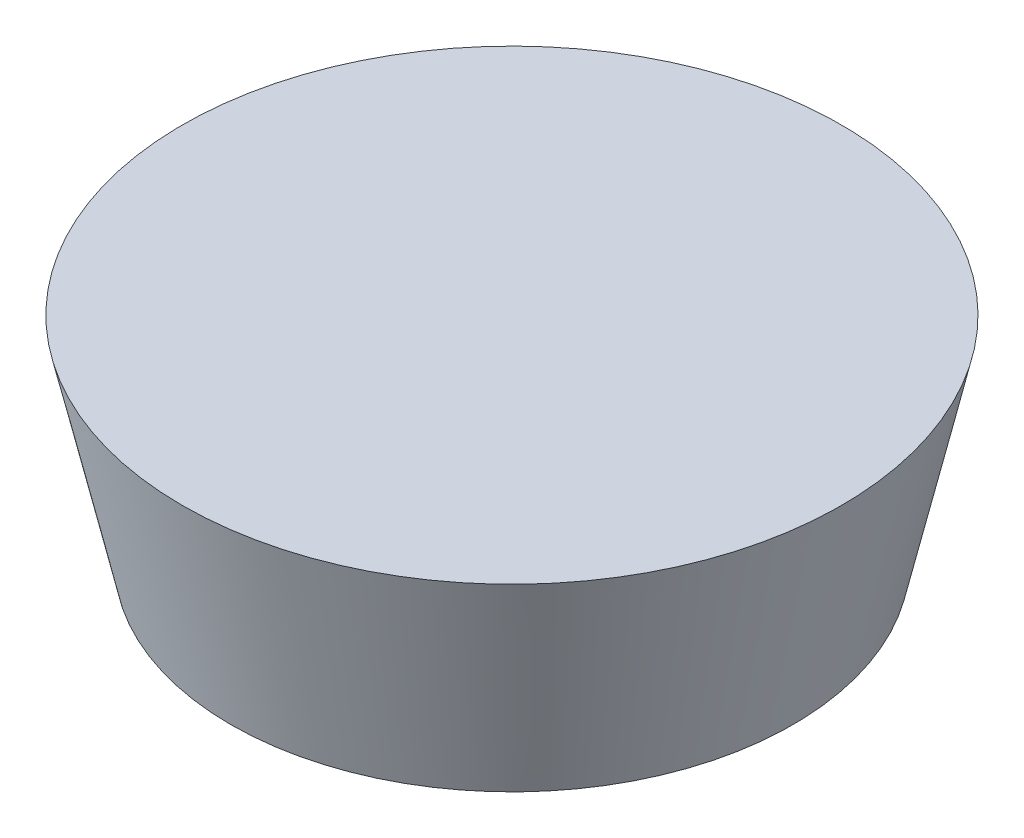
from build123d import *

# Parameters (mm, degrees)
SKETCH3_R          = 25.4
CUT_EXTRUDE1_DEPTH = 12.7


with BuildPart() as part:
    # Sketch2 → Revolve1 (revolve)
    with BuildSketch(Plane.XY):
        Polygon((0, 0), (0, 25.4), (-22.4234375, 25.4), (-16.66875, 0), align=None)
    revolve(axis=Axis((0, 0, 0), (0, 1, 0)))

    # Sketch3 → Cut-Extrude1 (cut)
    with BuildSketch(Plane(origin=(0, 25.4, 0), x_dir=(1, 0, 0), z_dir=(0, 1, 0))):
        Circle(SKETCH3_R)
    extrude(amount=-CUT_EXTRUDE1_DEPTH, mode=Mode.SUBTRACT)


solid = part.part
